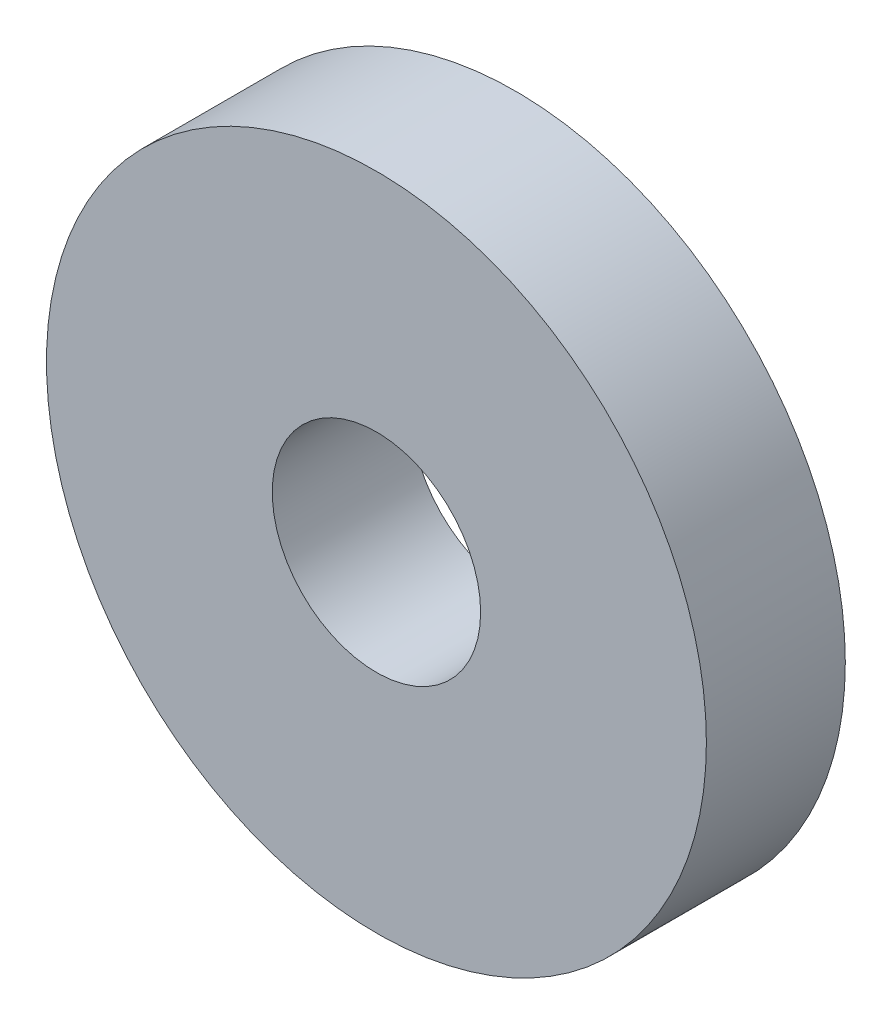
from build123d import *

# Parameters (mm, degrees)
SKETCH_1_R      = 9.5
SKETCH_1_R_2    = 3
EXTRUDE_1_DEPTH = 4


with BuildPart() as part:
    # 草图1 → 凸台-拉伸1 (new body)
    with BuildSketch(Plane.XY):
        Circle(SKETCH_1_R)
        Circle(SKETCH_1_R_2, mode=Mode.SUBTRACT)
    extrude(amount=EXTRUDE_1_DEPTH)


solid = part.part
